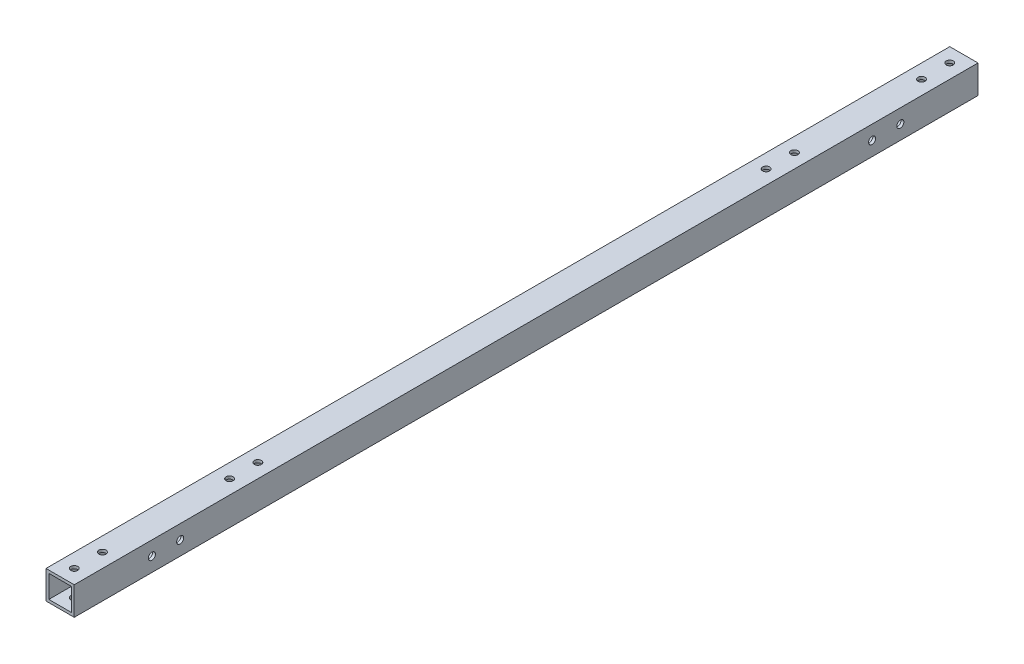
from build123d import *

# Parameters (mm, degrees)
SKETCH1_W           = 20
SKETCH1_H           = 20
SKETCH1_W_2         = 16
SKETCH1_H_2         = 16
BOSS_EXTRUDE1_DEPTH = 640
SKETCH2_R           = 2.5
CUT_EXTRUDE1_DEPTH  = 641.390505863
SKETCH3_R           = 2.5
CUT_EXTRUDE2_DEPTH  = 641.390505863
SKETCH4_R           = 2.5
CUT_EXTRUDE3_DEPTH  = 641.390505863


with BuildPart() as part:
    # Sketch1 → Boss-Extrude1 (new body)
    with BuildSketch(Plane.XY):
        Rectangle(SKETCH1_W, SKETCH1_H)
        Rectangle(SKETCH1_W_2, SKETCH1_H_2, mode=Mode.SUBTRACT)
    extrude(amount=BOSS_EXTRUDE1_DEPTH)

    # Sketch2 → Cut-Extrude1 (cut, through all)
    with BuildSketch(Plane(origin=(0, 10, 0), x_dir=(1, 0, 0), z_dir=(0, 1, 0))):
        with Locations(Location((0, -10, 0), (0, 0, 270))):
            Circle(SKETCH2_R)
        with Locations(Location((0, -630, 0), (0, 0, 270))):
            Circle(SKETCH2_R)
        with Locations(Location((0, -30, 0), (0, 0, 270))):
            Circle(SKETCH2_R)
        with Locations(Location((0, -610, 0), (0, 0, 270))):
            Circle(SKETCH2_R)
    extrude(amount=-CUT_EXTRUDE1_DEPTH, mode=Mode.SUBTRACT)

    # Sketch3 → Cut-Extrude2 (cut, through all)
    with BuildSketch(Plane(origin=(0, 10, 0), x_dir=(1, 0, 0), z_dir=(0, 1, 0))):
        with Locations(Location((0, -140, 0), (0, 0, 270))):
            Circle(SKETCH3_R)
        with Locations(Location((0, -500, 0), (0, 0, 270))):
            Circle(SKETCH3_R)
        with Locations(Location((0, -120, 0), (0, 0, 270))):
            Circle(SKETCH3_R)
        with Locations(Location((0, -520, 0), (0, 0, 270))):
            Circle(SKETCH3_R)
    extrude(amount=-CUT_EXTRUDE2_DEPTH, mode=Mode.SUBTRACT)

    # Sketch4 → Cut-Extrude3 (cut, through all)
    with BuildSketch(Plane.ZY.offset(10)):
        with Locations(Location((55, 0, 0), (0, 0, 270))):
            Circle(SKETCH4_R)
        with Locations(Location((75, 0, 0), (0, 0, 270))):
            Circle(SKETCH4_R)
        with Locations(Location((565, 0, 0), (0, 0, 270))):
            Circle(SKETCH4_R)
        with Locations(Location((585, 0, 0), (0, 0, 270))):
            Circle(SKETCH4_R)
    extrude(amount=-CUT_EXTRUDE3_DEPTH, mode=Mode.SUBTRACT)


solid = part.part
